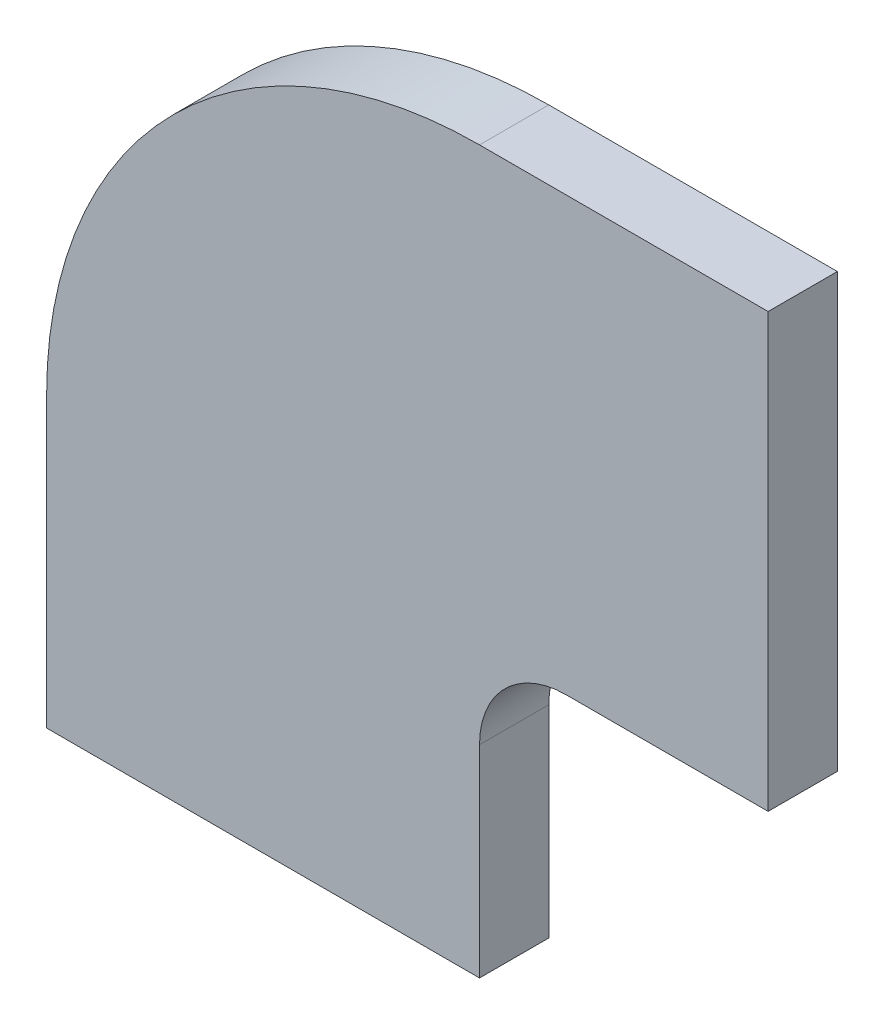
from build123d import *

# Parameters (mm, degrees)
BOSS_EXTRUDE1_DEPTH = 0.12
FILLET1_R           = 1.5
FILLET2_R           = 0.3


with BuildPart() as part:
    # Sketch1 → Boss-Extrude1 (new, symmetric)
    with BuildSketch(Plane.XY):
        Polygon((0, 0), (0, 1.5), (-2.5, 1.5), (-2.5, -1), (-1, -1), (-1, 0), align=None)
    extrude(amount=BOSS_EXTRUDE1_DEPTH, both=True)

    # Fillet1
    fillet1_edges = [part.edges().sort_by_distance(p)[0] for p in [
        (-2.5, 1.5, 0),
    ]]
    fillet(fillet1_edges, radius=FILLET1_R)

    # Fillet2
    fillet2_edges = [part.edges().sort_by_distance(p)[0] for p in [
        (-1, 0, 0),
    ]]
    fillet(fillet2_edges, radius=FILLET2_R)


solid = part.part
